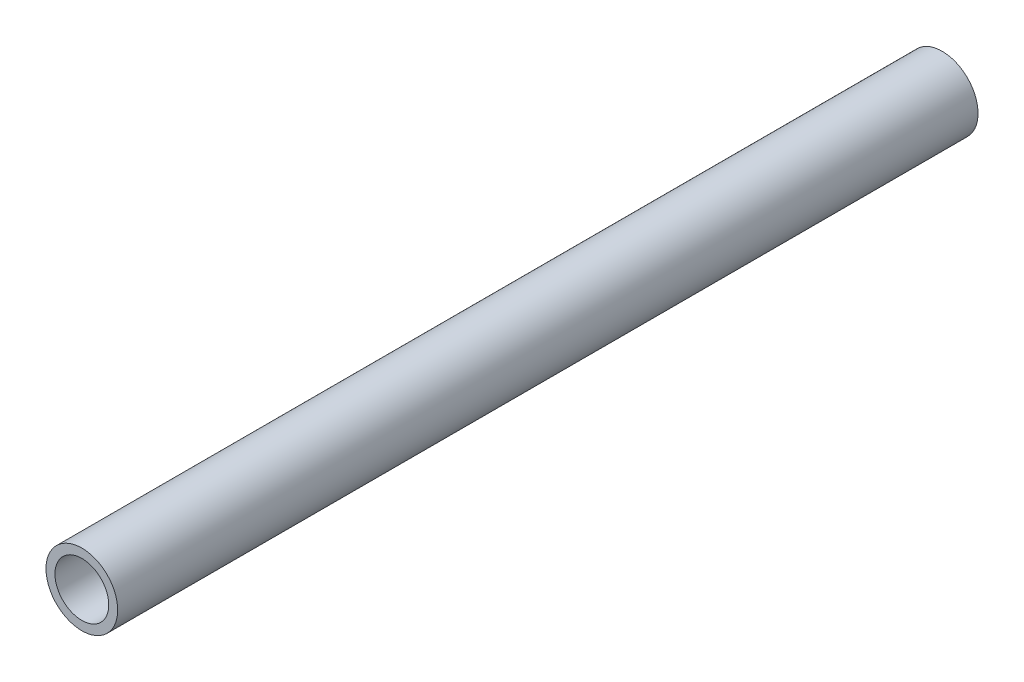
from build123d import *

# Parameters (mm, degrees)
SKETCH1_R           = 6.35
SKETCH1_R_2         = 4.7625
BOSS_EXTRUDE1_DEPTH = 152.4


with BuildPart() as part:
    # Sketch1 → Boss-Extrude1 (new body)
    with BuildSketch(Plane.XY):
        with Locations(Location((0, 0, 0), (0, 0, 180))):
            Circle(SKETCH1_R)
        with Locations(Location((0, 0, 0), (0, 0, 180))):
            Circle(SKETCH1_R_2, mode=Mode.SUBTRACT)
    extrude(amount=BOSS_EXTRUDE1_DEPTH)


solid = part.part
